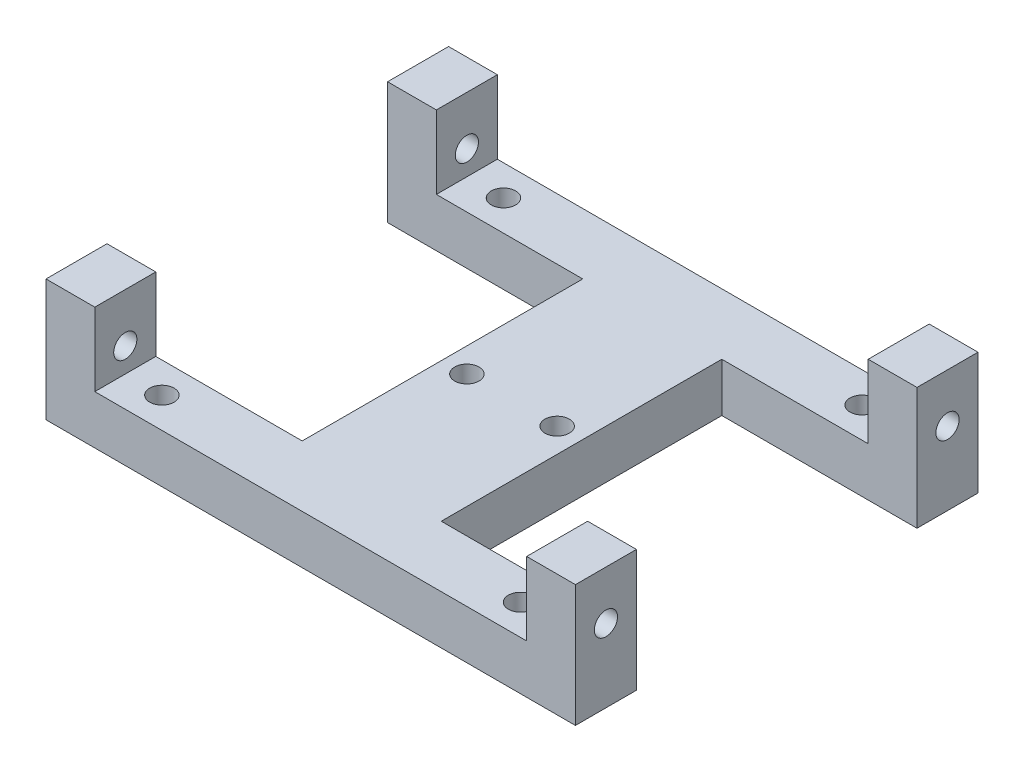
from build123d import *

# Parameters (mm, degrees)
EXTRUDE_1_DEPTH     = 4
SKETCH_2_W          = 4
SKETCH_2_H          = 5
EXTRUDE_2_DEPTH     = 6
SKETCH_3_R          = 0.95
CUT_EXTRUDE_1_DEPTH = 53.607604013
SKETCH_4_R          = 1
CUT_EXTRUDE_2_DEPTH = 52.995769059


with BuildPart() as part:
    # 草图1 → 凸台-拉伸1 (new body)
    with BuildSketch(Plane(origin=(0, 0, 0), x_dir=(1, 0, 0), z_dir=(0, 1, 0))):
        Polygon((0, 0), (0, -5), (20, -5), (23.4, -5), (43.4, -5), (43.4, 0), (27.4, 0), (27.4, 23), (43.4, 23), (43.4, 28), (23.4, 28), (20, 28), (0, 28), (0, 23), (16, 23), (16, 0), align=None)
    extrude(amount=EXTRUDE_1_DEPTH)

    # 草图2 → 凸台-拉伸2 (add)
    with BuildSketch(Plane(origin=(0, 4, 0), x_dir=(1, 0, 0), z_dir=(0, 1, 0))):
        with Locations((2, -2.5)):
            Rectangle(SKETCH_2_W, SKETCH_2_H)
        with Locations((2, 25.5)):
            Rectangle(SKETCH_2_W, SKETCH_2_H)
        with Locations((41.4, -2.5)):
            Rectangle(SKETCH_2_W, SKETCH_2_H)
        with Locations((41.4, 25.5)):
            Rectangle(SKETCH_2_W, SKETCH_2_H)
    extrude(amount=EXTRUDE_2_DEPTH)

    # 草图3 → 切除-拉伸1 (cut, through all)
    with BuildSketch(Plane.ZY):
        with Locations((2.5, 6)):
            Circle(SKETCH_3_R)
        with Locations((-25.5, 6)):
            Circle(SKETCH_3_R)
    extrude(amount=-CUT_EXTRUDE_1_DEPTH, mode=Mode.SUBTRACT)

    # 草图4 → 切除-拉伸2 (cut, through all)
    with BuildSketch(Plane(origin=(0, 4, 0), x_dir=(1, 0, 0), z_dir=(0, 1, 0))):
        with Locations(Location((7, -2.5, 0), (0, 0, 270))):
            Circle(SKETCH_4_R)
        with Locations(Location((7, 25.5, 0), (0, 0, 270))):
            Circle(SKETCH_4_R)
        with Locations(Location((18, 11.5, 0), (0, 0, 270))):
            Circle(SKETCH_4_R)
        with Locations(Location((36.4, -2.5, 0), (0, 0, 90))):
            Circle(SKETCH_4_R)
        with Locations(Location((36.4, 25.5, 0), (0, 0, 90))):
            Circle(SKETCH_4_R)
        with Locations(Location((25.4, 11.5, 0), (0, 0, 90))):
            Circle(SKETCH_4_R)
    extrude(amount=-CUT_EXTRUDE_2_DEPTH, mode=Mode.SUBTRACT)


solid = part.part
